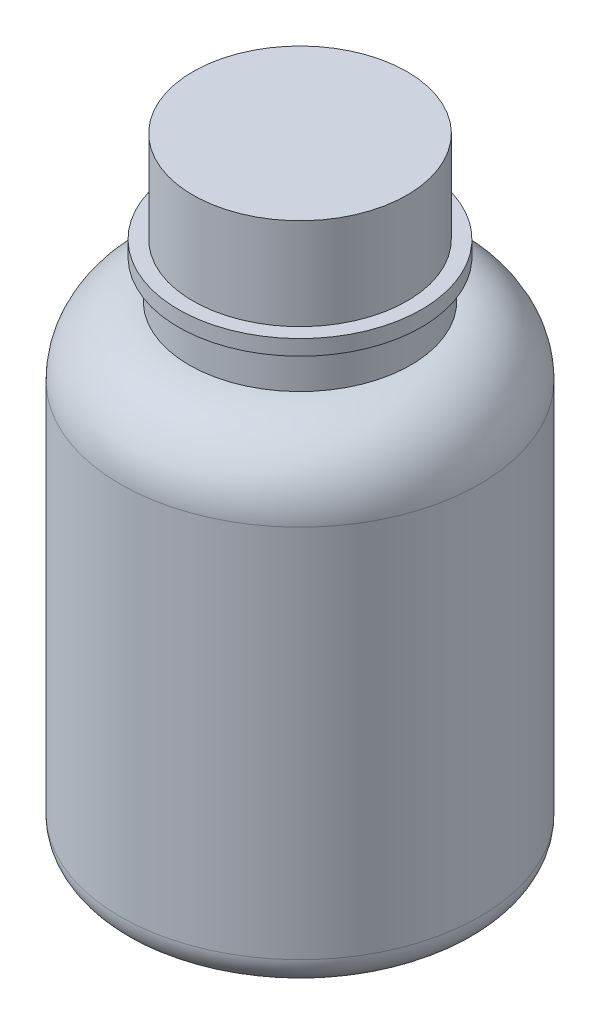
from build123d import *


with BuildPart() as part:
    # 草图1 → 旋转1 (revolve)
    with BuildSketch(Plane.XY, mode=Mode.PRIVATE) as revolve_1_sk:
        with BuildLine():
            Line((0, 56), (0, -25))
            Line((0, -25), (19.5, -25))
            ThreePointArc((19.5, -25), (22.328427125, -23.828427125), (23.5, -21))
            Line((23.5, -21), (23.5, 25))
            Line((23.5, 25), (23.5, 28))
            ThreePointArc((23.5, 28), (20.863961031, 34.363961031), (14.5, 37))
            Line((14.5, 37), (14.5, 42))
            Line((14.5, 42), (15.90903206, 42))
            Line((15.90903206, 42), (15.90903206, 44))
            Line((15.90903206, 44), (14, 44))
            Line((14, 44), (14, 56))
            Line((14, 56), (0, 56))
        make_face()
    revolve(revolve_1_sk.sketch.rotate(Axis((0, 0, 0), (0, 1, 0)), 90), axis=Axis((0, 0, 0), (0, 1, 0)))


solid = part.part
